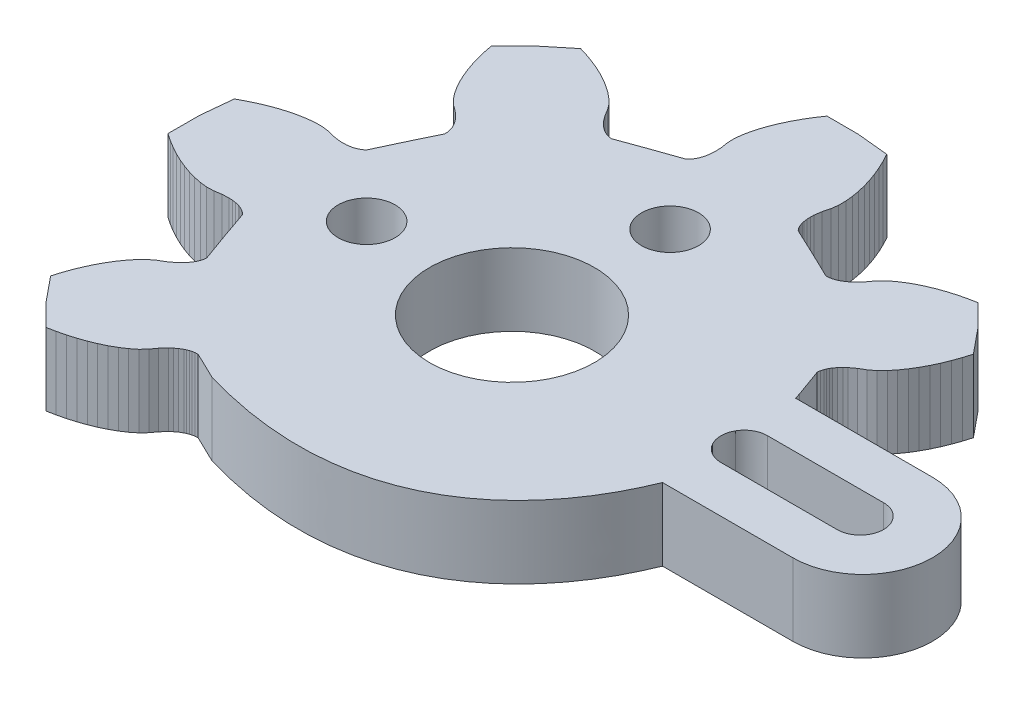
from build123d import *

# Parameters (mm, degrees)
SKETCH1_R           = 1.25
SKETCH1_R_2         = 3.615039354
BOSS_EXTRUDE1_DEPTH = 3.175


with BuildPart() as part:
    # Sketch1 → Boss-Extrude1 (new body)
    with BuildSketch(Plane(origin=(0, 0, 0), x_dir=(1, 0, 0), z_dir=(0, 1, 0))):
        with BuildLine():
            Line((16.77844466, -3.969424908), (11.071588976, -3.969424908))
            add(Edge.make_bspline(
                [(-2.830333316, -9.83740885), (8.262530845, -13.145039943), (10.954032576, -3.969424908), (11.071588976, -3.969424908)],
                knots=[226, 226, 226, 226, 227, 227, 227, 227], degree=3))
            Line((-2.830333316, -9.83740885), (-3.985376432, -9.280378139))
            Line((-3.985376432, -9.280378139), (-4.119605442, -9.283835409))
            Line((-4.119605442, -9.283835409), (-4.228215028, -9.303426608))
            Line((-4.228215028, -9.303426608), (-4.323157023, -9.331201966))
            Line((-4.323157023, -9.331201966), (-4.408959669, -9.365130094))
            Line((-4.408959669, -9.365130094), (-4.488113743, -9.403199133))
            Line((-4.488113743, -9.403199133), (-4.631545468, -9.489611359))
            Line((-4.631545468, -9.489611359), (-4.760154387, -9.585750821))
            Line((-4.760154387, -9.585750821), (-4.877518252, -9.689879116))
            Line((-4.877518252, -9.689879116), (-5.085027781, -9.917219057))
            Line((-5.085027781, -9.917219057), (-5.264173645, -10.165048696))
            Line((-5.264173645, -10.165048696), (-5.474427415, -10.390220518))
            Line((-5.474427415, -10.390220518), (-5.722315807, -10.587421656))
            Line((-5.722315807, -10.587421656), (-5.993781282, -10.766691867))
            Line((-5.993781282, -10.766691867), (-6.284475947, -10.929593758))
            Line((-6.284475947, -10.929593758), (-6.592352588, -11.077299285))
            Line((-6.592352588, -11.077299285), (-6.915632079, -11.210238167))
            Line((-6.915632079, -11.210238167), (-7.253217697, -11.328390869))
            Line((-7.253217697, -11.328390869), (-7.604158951, -11.431835523))
            Line((-7.604158951, -11.431835523), (-7.967427359, -11.520533063))
            Line((-7.967427359, -11.520533063), (-8.342520866, -11.594210034))
            Line((-8.342520866, -11.594210034), (-9.318676457, -10.610645919))
            Line((-9.318676457, -10.610645919), (-10.196122203, -9.538188937))
            Line((-10.196122203, -9.538188937), (-10.084890233, -9.171894074))
            Line((-10.084890233, -9.171894074), (-9.959927304, -8.818646988))
            Line((-9.959927304, -8.818646988), (-9.82160874, -8.479561037))
            Line((-9.82160874, -8.479561037), (-9.669807809, -8.154987809))
            Line((-9.669807809, -8.154987809), (-9.505036313, -7.846372716))
            Line((-9.505036313, -7.846372716), (-9.326982297, -7.55463379))
            Line((-9.326982297, -7.55463379), (-9.135952842, -7.281196911))
            Line((-9.135952842, -7.281196911), (-8.930358921, -7.029031034))
            Line((-8.930358921, -7.029031034), (-8.70943039, -6.801691093))
            Line((-8.70943039, -6.801691093), (-8.464227749, -6.615369614))
            Line((-8.464227749, -6.615369614), (-8.199986016, -6.46168711))
            Line((-8.199986016, -6.46168711), (-7.95331133, -6.278119728))
            Line((-7.95331133, -6.278119728), (-7.837989805, -6.171745184))
            Line((-7.837989805, -6.171745184), (-7.729316852, -6.053475286))
            Line((-7.729316852, -6.053475286), (-7.629139838, -5.919071459))
            Line((-7.629139838, -5.919071459), (-7.583140885, -5.844300663))
            Line((-7.583140885, -5.844300663), (-7.540783049, -5.762127012))
            Line((-7.540783049, -5.762127012), (-7.503280035, -5.67034332))
            Line((-7.503280035, -5.67034332), (-7.473249353, -5.563968776))
            Line((-7.473249353, -5.563968776), (-7.455999136, -5.430463449))
            Line((-7.455999136, -5.430463449), (-7.891914401, -4.223075261))
            Line((-7.891914401, -4.223075261), (-8.315561005, -3.01070626))
            Line((-8.315561005, -3.01070626), (-8.412988902, -2.918219395))
            Line((-8.412988902, -2.918219395), (-8.50332954, -2.854914236))
            Line((-8.50332954, -2.854914236), (-8.590282525, -2.807352353))
            Line((-8.590282525, -2.807352353), (-8.674866591, -2.770494335))
            Line((-8.674866591, -2.770494335), (-8.757798262, -2.741507956))
            Line((-8.757798262, -2.741507956), (-8.919884008, -2.700860613))
            Line((-8.919884008, -2.700860613), (-9.078898932, -2.677812144))
            Line((-9.078898932, -2.677812144), (-9.235364588, -2.668534159))
            Line((-9.235364588, -2.668534159), (-9.542475961, -2.682167914))
            Line((-9.542475961, -2.682167914), (-9.84403061, -2.730237645))
            Line((-9.84403061, -2.730237645), (-10.151722027, -2.740921977))
            Line((-10.151722027, -2.740921977), (-10.466305732, -2.704630405))
            Line((-10.466305732, -2.704630405), (-10.784667034, -2.638961801))
            Line((-10.784667034, -2.638961801), (-11.105192534, -2.548271935))
            Line((-11.105192534, -2.548271935), (-11.427063347, -2.434670329))
            Line((-11.427063347, -2.434670329), (-11.74957757, -2.299680525))
            Line((-11.74957757, -2.299680525), (-12.071765213, -2.144025229))
            Line((-12.071765213, -2.144025229), (-12.392870757, -1.968583408))
            Line((-12.392870757, -1.968583408), (-12.712504257, -1.773941041))
            Line((-12.712504257, -1.773941041), (-13.029583614, -1.560371583))
            Line((-13.029583614, -1.560371583), (-13.025625666, -0.173517859))
            Line((-13.025625666, -0.173517859), (-12.889095977, 1.206616651))
            Line((-12.889095977, 1.206616651), (-12.551890556, 1.386785361))
            Line((-12.551890556, 1.386785361), (-12.214300063, 1.547890253))
            Line((-12.214300063, 1.547890253), (-11.876904543, 1.689911794))
            Line((-11.876904543, 1.689911794), (-11.540786095, 1.811638962))
            Line((-11.540786095, 1.811638962), (-11.206076325, 1.913286617))
            Line((-11.206076325, 1.913286617), (-10.874300895, 1.993682802))
            Line((-10.874300895, 1.993682802), (-10.546361555, 2.051343039))
            Line((-10.546361555, 2.051343039), (-10.223082064, 2.084177341))
            Line((-10.223082064, 2.084177341), (-9.906324412, 2.088337785))
            Line((-9.906324412, 2.088337785), (-9.601382111, 2.046420824))
            Line((-9.601382111, 2.046420824), (-9.306344428, 1.96768491))
            Line((-9.306344428, 1.96768491), (-9.00191393, 1.922877124))
            Line((-9.00191393, 1.922877124), (-8.845643248, 1.916353235))
            Line((-8.845643248, 1.916353235), (-8.685156279, 1.92307245))
            Line((-8.685156279, 1.92307245), (-8.519619515, 1.947019418))
            Line((-8.519619515, 1.947019418), (-8.434138574, 1.967489584))
            Line((-8.434138574, 1.967489584), (-8.34635208, 1.99585092))
            Line((-8.34635208, 1.99585092), (-8.255056077, 2.034134818))
            Line((-8.255056077, 2.034134818), (-8.158520179, 2.087829938))
            Line((-8.158520179, 2.087829938), (-8.052211271, 2.170003589))
            Line((-8.052211271, 2.170003589), (-7.508198223, 3.332779317))
            Line((-7.508198223, 3.332779317), (-6.952174851, 4.489910123))
            Line((-6.952174851, 4.489910123), (-6.955625869, 4.624196754))
            Line((-6.955625869, 4.624196754), (-6.97485506, 4.733247264))
            Line((-6.97485506, 4.733247264), (-7.002901894, 4.828312432))
            Line((-7.002901894, 4.828312432), (-7.036573693, 4.914334006))
            Line((-7.036573693, 4.914334006), (-7.074647002, 4.993558235))
            Line((-7.074647002, 4.993558235), (-7.16083472, 5.13725958))
            Line((-7.16083472, 5.13725958), (-7.256795447, 5.266096615))
            Line((-7.256795447, 5.266096615), (-7.360745184, 5.383468013))
            Line((-7.360745184, 5.383468013), (-7.587674002, 5.59154881))
            Line((-7.587674002, 5.59154881), (-7.834860491, 5.771033879))
            Line((-7.834860491, 5.771033879), (-8.060005308, 5.98147812))
            Line((-8.060005308, 5.98147812), (-8.256844952, 6.230069531))
            Line((-8.256844952, 6.230069531), (-8.435605744, 6.502021933))
            Line((-8.435605744, 6.502021933), (-8.598203293, 6.793174881))
            Line((-8.598203293, 6.793174881), (-8.745656332, 7.101418854))
            Line((-8.745656332, 7.101418854), (-8.878418172, 7.425484235))
            Line((-8.878418172, 7.425484235), (-8.99629384, 7.763867012))
            Line((-8.99629384, 7.763867012), (-9.099858506, 8.115258501))
            Line((-9.099858506, 8.115258501), (-9.188278661, 8.479248517))
            Line((-9.188278661, 8.479248517), (-9.261812645, 8.854762768))
            Line((-9.261812645, 8.854762768), (-8.280036964, 9.832681962))
            Line((-8.280036964, 9.832681962), (-7.20939269, 10.711902923))
            Line((-7.20939269, 10.711902923), (-6.843565264, 10.600469435))
            Line((-6.843565264, 10.600469435), (-6.491283573, 10.475284996))
            Line((-6.491283573, 10.475284996), (-6.152606107, 10.336720726))
            Line((-6.152606107, 10.336720726), (-5.828819686, 10.18444457))
            Line((-5.828819686, 10.18444457), (-5.52062134, 10.019569886))
            Line((-5.52062134, 10.019569886), (-5.229224773, 9.841198175))
            Line((-5.229224773, 9.841198175), (-4.956613833, 9.649622426))
            Line((-4.956613833, 9.649622426), (-4.704699254, 9.443846477))
            Line((-4.704699254, 9.443846477), (-4.47795566, 9.222522577))
            Line((-4.47795566, 9.222522577), (-4.291785902, 8.976880588))
            Line((-4.291785902, 8.976880588), (-4.138581167, 8.712155249))
            Line((-4.138581167, 8.712155249), (-3.95515565, 8.464911588))
            Line((-3.95515565, 8.464911588), (-3.849036841, 8.349317656))
            Line((-3.849036841, 8.349317656), (-3.730971074, 8.240638265))
            Line((-3.730971074, 8.240638265), (-3.596932163, 8.140143034))
            Line((-3.596932163, 8.140143034), (-3.521926135, 8.094260955))
            Line((-3.521926135, 8.094260955), (-3.440086311, 8.051758015))
            Line((-3.440086311, 8.051758015), (-3.348468602, 8.014196824))
            Line((-3.348468602, 8.014196824), (-3.242349793, 7.983921292))
            Line((-3.242349793, 7.983921292), (-3.109207756, 7.966693538))
            Line((-3.109207756, 7.966693538), (-1.903627696, 8.403598754))
            Line((-1.903627696, 8.403598754), (-0.693704618, 8.827749181))
            Line((-0.693704618, 8.827749181), (-0.601321641, 8.925353587))
            Line((-0.601321641, 8.925353587), (-0.538325936, 9.016043453))
            Line((-0.538325936, 9.016043453), (-0.490854938, 9.103158853))
            Line((-0.490854938, 9.103158853), (-0.453927094, 9.187891275))
            Line((-0.453927094, 9.187891275), (-0.42472992, 9.270787633))
            Line((-0.42472992, 9.270787633), (-0.384355932, 9.43335747))
            Line((-0.384355932, 9.43335747), (-0.361354018, 9.592470036))
            Line((-0.361354018, 9.592470036), (-0.352156177, 9.749219158))
            Line((-0.352156177, 9.749219158), (-0.365697037, 10.05715061))
            Line((-0.365697037, 10.05715061), (-0.413869936, 10.359183217))
            Line((-0.413869936, 10.359183217), (-0.424413089, 10.66742719))
            Line((-0.424413089, 10.66742719), (-0.388187147, 10.982390379))
            Line((-0.388187147, 10.982390379), (-0.322637299, 11.301396816))
            Line((-0.322637299, 11.301396816), (-0.232233295, 11.622688567))
            Line((-0.232233295, 11.622688567), (-0.11870552, 11.945074144))
            Line((-0.11870552, 11.945074144), (0.016035293, 12.268182427))
            Line((0.016035293, 12.268182427), (0.171287243, 12.590763329))
            Line((0.171287243, 12.590763329), (0.346402045, 12.912641058))
            Line((0.346402045, 12.912641058), (0.540687545, 13.232858517))
            Line((0.540687545, 13.232858517), (0.754012137, 13.550575802))
            Line((0.754012137, 13.550575802), (2.138352989, 13.546337227))
            Line((2.138352989, 13.546337227), (3.516050144, 13.409569956))
            Line((3.516050144, 13.409569956), (3.695834544, 13.071948951))
            Line((3.695834544, 13.071948951), (3.85670171, 12.733741967))
            Line((3.85670171, 12.733741967), (3.998281193, 12.395925636))
            Line((3.998281193, 12.395925636), (4.119988076, 12.059007804))
            Line((4.119988076, 12.059007804), (4.221442162, 11.723750243))
            Line((4.221442162, 11.723750243), (4.301434619, 11.391383508))
            Line((4.301434619, 11.391383508), (4.359058824, 11.062786564))
            Line((4.359058824, 11.062786564), (4.392028721, 10.738916509))
            Line((4.392028721, 10.738916509), (4.395986668, 10.421589876))
            Line((4.395986668, 10.421589876), (4.354330734, 10.116099999))
            Line((4.354330734, 10.116099999), (4.275751829, 9.820337357))
            Line((4.275751829, 9.820337357), (4.231029948, 9.515531121))
            Line((4.231029948, 9.515531121), (4.224512983, 9.358606206))
            Line((4.224512983, 9.358606206), (4.231220047, 9.198087293))
            Line((4.231220047, 9.198087293), (4.255113961, 9.032235979))
            Line((4.255113961, 9.032235979), (4.275556857, 8.946605057))
            Line((4.275556857, 8.946605057), (4.303603691, 8.858591157))
            Line((4.303603691, 8.858591157), (4.34200358, 8.76713952))
            Line((4.34200358, 8.76713952), (4.395606471, 8.670609407))
            Line((4.395606471, 8.670609407), (4.477509661, 8.564117667))
            Line((4.477509661, 8.564117667), (5.638177741, 8.018923713))
            Line((5.638177741, 8.018923713), (6.79321842, 7.461756274))
            Line((6.79321842, 7.461756274), (6.927639965, 7.46540887))
            Line((6.927639965, 7.46540887), (7.036251989, 7.484804743))
            Line((7.036251989, 7.484804743), (7.131191547, 7.512716829))
            Line((7.131191547, 7.512716829), (7.216994192, 7.546703555))
            Line((7.216994192, 7.546703555), (7.296150704, 7.584772594))
            Line((7.296150704, 7.584772594), (7.439579991, 7.670930896))
            Line((7.439579991, 7.670930896), (7.568188911, 7.767128955))
            Line((7.568188911, 7.767128955), (7.68536024, 7.871452576))
            Line((7.68536024, 7.871452576), (7.892872206, 8.098616724))
            Line((7.892872206, 8.098616724), (8.072015632, 8.346426831))
            Line((8.072015632, 8.346426831), (8.28227184, 8.571735381))
            Line((8.28227184, 8.571735381), (8.530352767, 8.769112313))
            Line((8.530352767, 8.769112313), (8.801815805, 8.948011404))
            Line((8.801815805, 8.948011404), (9.092508033, 9.110971893))
            Line((9.092508033, 9.110971893), (9.400197013, 9.258618822))
            Line((9.400197013, 9.258618822), (9.723664165, 9.391811627))
            Line((9.723664165, 9.391811627), (10.061252221, 9.509905732))
            Line((10.061252221, 9.509905732), (10.412193475, 9.613526179))
            Line((10.412193475, 9.613526179), (10.77546432, 9.702047926))
            Line((10.77546432, 9.702047926), (11.150362854, 9.77590069))
            Line((11.150362854, 9.77590069), (12.126518444, 8.792160782))
            Line((12.126518444, 8.792160782), (13.004156727, 7.719762398))
            Line((13.004156727, 7.719762398), (12.892734658, 7.353467535))
            Line((12.892734658, 7.353467535), (12.767961828, 7.000220448))
            Line((12.767961828, 7.000220448), (12.629450728, 6.661134498))
            Line((12.629450728, 6.661134498), (12.477842332, 6.336365944))
            Line((12.477842332, 6.336365944), (12.312880738, 6.027750851))
            Line((12.312880738, 6.027750851), (12.13501682, 5.736011925))
            Line((12.13501682, 5.736011925), (11.943604731, 5.462770372))
            Line((11.943604731, 5.462770372), (11.738203346, 5.210604495))
            Line((11.738203346, 5.210604495), (11.517277252, 4.983264554))
            Line((11.517277252, 4.983264554), (11.272072174, 4.796943075))
            Line((11.272072174, 4.796943075), (11.007828003, 4.643455897))
            Line((11.007828003, 4.643455897), (10.761153317, 4.459634591))
            Line((10.761153317, 4.459634591), (10.64583423, 4.353318644))
            Line((10.64583423, 4.353318644), (10.53715884, 4.23485342))
            Line((10.53715884, 4.23485342), (10.436981826, 4.100762116))
            Line((10.436981826, 4.100762116), (10.390982873, 4.025678798))
            Line((10.390982873, 4.025678798), (10.348815135, 3.943641875))
            Line((10.348815135, 3.943641875), (10.311504657, 3.851858183))
            Line((10.311504657, 3.851858183), (10.280901242, 3.745542237))
            Line((10.280901242, 3.745542237), (10.263906927, 3.612154106))
            Line((10.263906927, 3.612154106), (10.699948925, 2.404394798))
            Line((10.699948925, 2.404394798), (10.77859607, 2.15093977))
            Line((10.77859607, 2.15093977), (16.77844466, 2.15093977))
            ThreePointArc((16.77844466, 2.15093977), (19.838626999, -0.909242569), (16.77844466, -3.969424908))
        make_face()
        with Locations(Location((-5.342499084, -0.53641405, 0), (0, 0, 270))):
            Circle(SKETCH1_R, mode=Mode.SUBTRACT)
        with Locations(Location((1.612038594, 5.814044666, 0), (0, 0, 270))):
            Circle(SKETCH1_R, mode=Mode.SUBTRACT)
        with Locations(Location((1.403922212, -0.909242569, 0), (0, 0, 270))):
            Circle(SKETCH1_R_2, mode=Mode.SUBTRACT)
        with BuildLine():
            Line((11.585893047, -1.929225218), (16.676861405, -1.929225218))
            add(Edge.make_bspline(
                [(16.676861405, -1.929225218), (17.239019108, -1.929225218), (17.694865465, -1.472416283), (17.694865465, -0.909252335)],
                knots=[4, 4, 4, 4, 5, 5, 5, 5], degree=3))
            add(Edge.make_bspline(
                [(17.694865465, -0.909252335), (17.694865465, -0.345873529), (17.239019108, 0.110798678), (16.676861405, 0.110798678)],
                knots=[5, 5, 5, 5, 6, 6, 6, 6], degree=3))
            Line((16.676861405, 0.110798678), (11.585893048, 0.110798678))
            add(Edge.make_bspline(
                [(11.585893048, 0.110798678), (11.222110399, 0.110798678), (10.885991951, -0.083531168), (10.703972675, -0.399256127)],
                knots=[0, 0, 0, 0, 1, 1, 1, 1], degree=3))
            add(Edge.make_bspline(
                [(10.703972675, -0.399256127), (10.522145936, -0.71492249), (10.522145936, -1.103562648), (10.703972675, -1.41922901)],
                knots=[1, 1, 1, 1, 2, 2, 2, 2], degree=3))
            add(Edge.make_bspline(
                [(10.703972675, -1.41922901), (10.885991951, -1.734895372), (11.222110399, -1.929225218), (11.585893047, -1.929225218)],
                knots=[2, 2, 2, 2, 3, 3, 3, 3], degree=3))
        make_face(mode=Mode.SUBTRACT)
    extrude(amount=BOSS_EXTRUDE1_DEPTH)


solid = part.part
